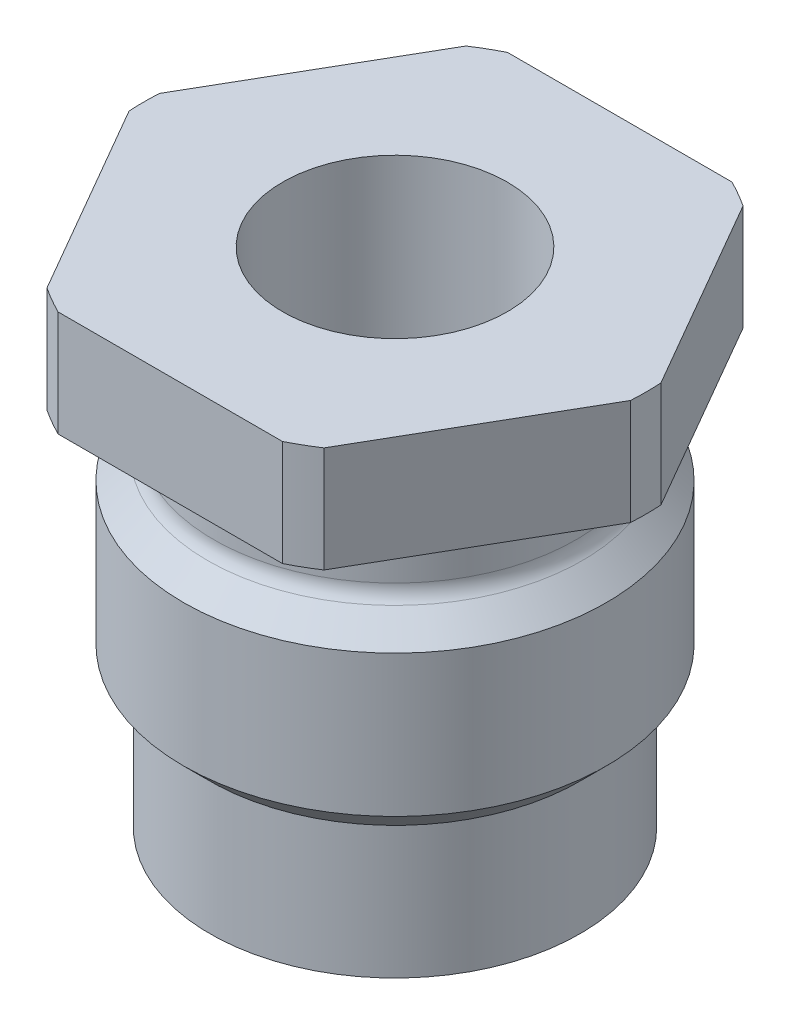
from build123d import *

# Parameters (mm, degrees)
SKETCH_2_OUTSIDE_W  = 27.582
SKETCH_2_OUTSIDE_H  = 27.582
CUT_EXTRUDE_1_DEPTH = 24.270152556


with BuildPart() as part:
    # Эскиз1 → Повернуть1 (revolve)
    with BuildSketch(Plane.XY, mode=Mode.PRIVATE) as revolve_1_sk:
        with BuildLine():
            Line((-4.25, 0), (-7, 0))
            Line((-7, 0), (-7, 5))
            Line((-7, 5), (-8, 6))
            Line((-8, 6), (-8, 11.35))
            Line((-8, 11.35), (-7.084314575, 12.265685425))
            ThreePointArc((-7.084314575, 12.265685425), (-6.910896374, 12.525224104), (-6.85, 12.83137085))
            Line((-6.85, 12.83137085), (-6.85, 14.2))
            ThreePointArc((-6.85, 14.2), (-7.084314575, 14.765685425), (-7.65, 15))
            Line((-7.65, 15), (-9.5, 15))
            Line((-9.5, 15), (-9.5, 19))
            Line((-9.5, 19), (-4.25, 19))
            Line((-4.25, 19), (-4.25, 0))
        make_face()
    revolve(revolve_1_sk.sketch.rotate(Axis((0, 0, 0), (0, 1, 0)), 270), axis=Axis((0, 0, 0), (0, 1, 0)))

    # Эскиз2 outside → Вырез-Вытянуть1 (cut, through all)
    with BuildSketch(Plane(origin=(0, 19, 0), x_dir=(1, 0, 0), z_dir=(0, 1, 0))):
        Rectangle(SKETCH_2_OUTSIDE_W, SKETCH_2_OUTSIDE_H)
        Polygon((9.814954576, 0), (4.907477288, 8.5), (-4.907477288, 8.5), (-9.814954576, 0), (-4.907477288, -8.5), (4.907477288, -8.5), align=None, mode=Mode.SUBTRACT)
    extrude(amount=-CUT_EXTRUDE_1_DEPTH, mode=Mode.SUBTRACT)


solid = part.part
